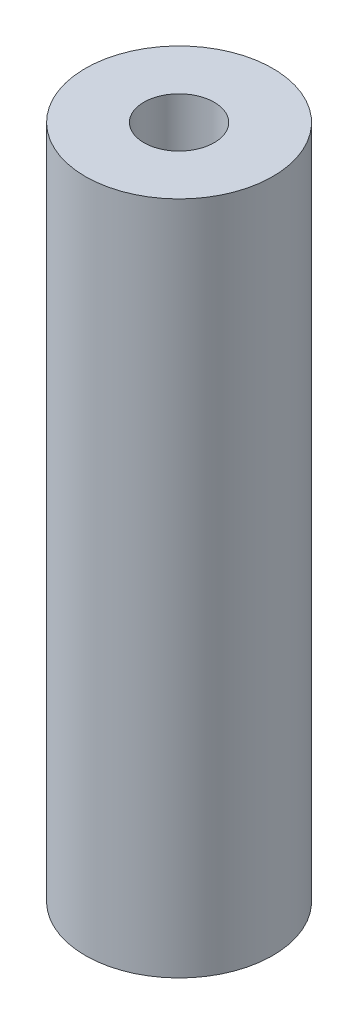
from build123d import *

# Parameters (mm, degrees)
SKETCH1_R           = 4
SKETCH1_R_2         = 1.5
BOSS_EXTRUDE1_DEPTH = 28.8


with BuildPart() as part:
    # Sketch1 → Boss-Extrude1 (new body)
    with BuildSketch(Plane(origin=(0, 0, 0), x_dir=(1, 0, 0), z_dir=(0, 1, 0))):
        with Locations(Location((0, 0, 0), (0, 0, 270))):
            Circle(SKETCH1_R)
        with Locations(Location((0, 0, 0), (0, 0, 270))):
            Circle(SKETCH1_R_2, mode=Mode.SUBTRACT)
    extrude(amount=BOSS_EXTRUDE1_DEPTH)


solid = part.part
